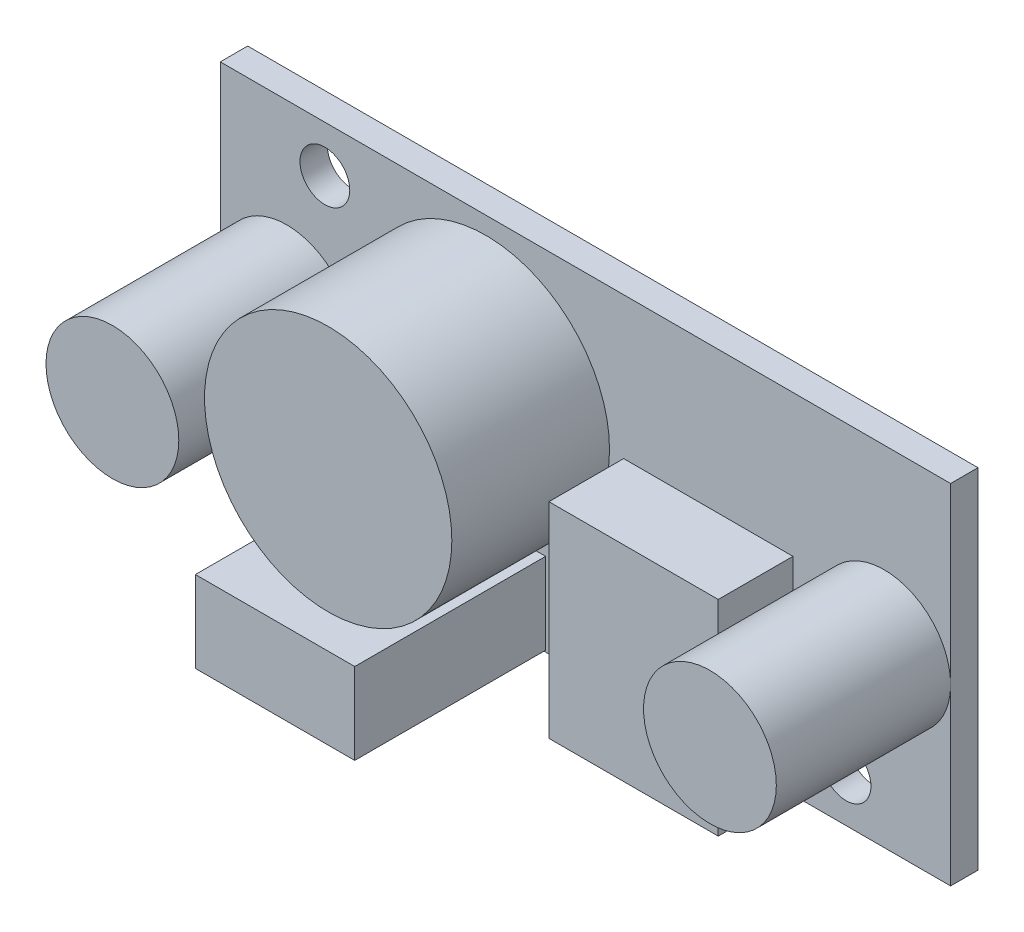
from build123d import *

# Parameters (mm, degrees)
SKETCH_1_W         = 44
SKETCH_1_H         = 21
SKETCH_1_R         = 1.5
EXTRUDE_484_DEPTH  = 1.65
SKETCH_2_R         = 4
EXTRUDE_1078_DEPTH = 10.5
SKETCH_2_3_W       = 9.6
SKETCH_2_3_H       = 4.9
EXTRUDE_1123_DEPTH = 11.5
SKETCH_2_4_R       = 7.45
EXTRUDE_1263_DEPTH = 9.5
SKETCH_2_5_W       = 10.2
SKETCH_2_5_H       = 12.35
EXTRUDE_1351_DEPTH = 4.5


with BuildPart() as part:
    # Эскиз1 → Extrude 484 (new body)
    with BuildSketch(Plane.XY):
        Rectangle(SKETCH_1_W, SKETCH_1_H)
        with Locations((-15.7, 7.7)):
            Circle(SKETCH_1_R, mode=Mode.SUBTRACT)
        with Locations((15.7, -7.7)):
            Circle(SKETCH_1_R, mode=Mode.SUBTRACT)
    extrude(amount=EXTRUDE_484_DEPTH)

    # Эскиз2 → Extrude 1078 (add)
    with BuildSketch(Plane.XY.offset(1.65)):
        with Locations((-18, 0)):
            Circle(SKETCH_2_R)
        with Locations((18, 0)):
            Circle(SKETCH_2_R)
    extrude(amount=EXTRUDE_1078_DEPTH)

    # Эскиз2<3> → Extrude 1123 (add)
    with BuildSketch(Plane.XY.offset(1.65)):
        with Locations((-7.2, -7.95)):
            Rectangle(SKETCH_2_3_W, SKETCH_2_3_H)
    extrude(amount=EXTRUDE_1123_DEPTH)

    # Эскиз2<4> → Extrude 1263 (add)
    with BuildSketch(Plane.XY.offset(1.65)):
        with Locations((-6, 2)):
            Circle(SKETCH_2_4_R)
    extrude(amount=EXTRUDE_1263_DEPTH)

    # Эскиз2<5> → Extrude 1351 (add)
    with BuildSketch(Plane.XY.offset(1.65)):
        with Locations((7.4, -4.225)):
            Rectangle(SKETCH_2_5_W, SKETCH_2_5_H)
    extrude(amount=EXTRUDE_1351_DEPTH)


solid = part.part
